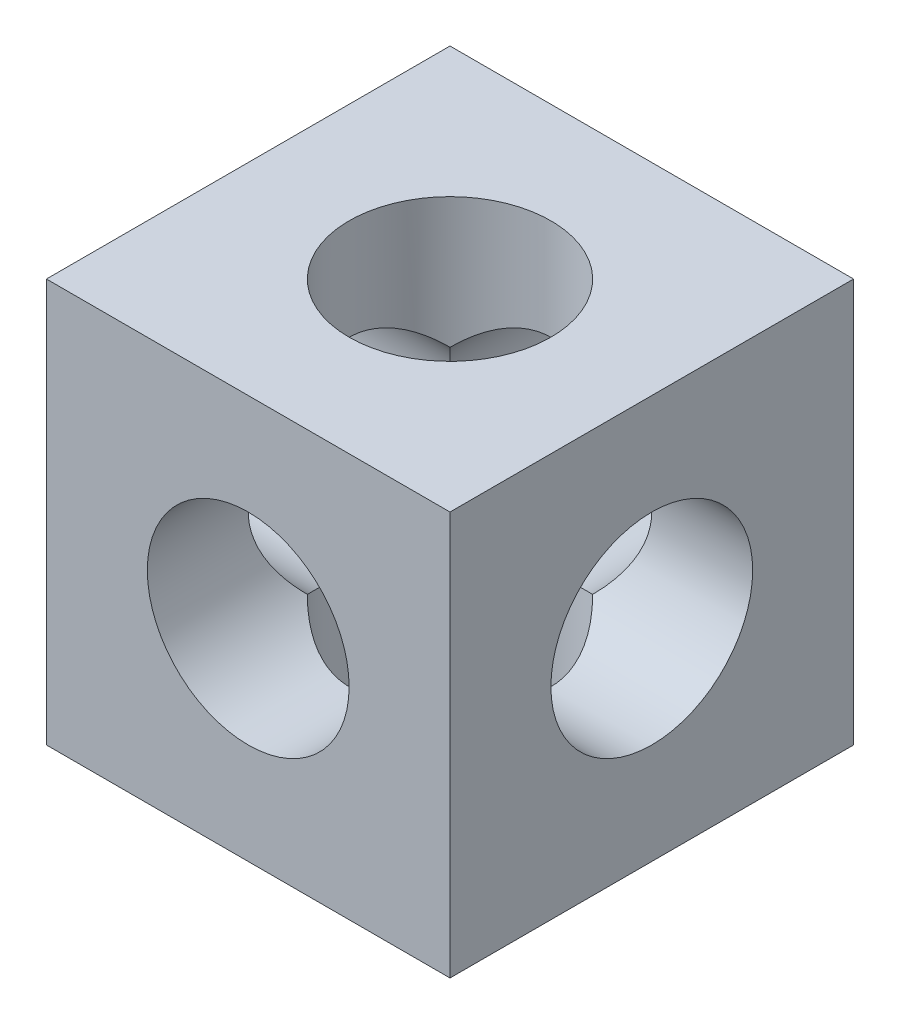
from build123d import *

# Parameters (mm, degrees)
SKETCH_1_W          = 6
SKETCH_1_H          = 6
SKETCH_1_R          = 1.5
EXTRUDE_1_DEPTH     = 6
SKETCH_2_R          = 1.5
CUT_EXTRUDE_1_DEPTH = 6
SKETCH_3_R          = 1.5
CUT_EXTRUDE_2_DEPTH = 6


with BuildPart() as part:
    # 草图1 → 凸台-拉伸1 (new body)
    with BuildSketch(Plane(origin=(0, 0, 0), x_dir=(1, 0, 0), z_dir=(0, 1, 0))):
        with Locations((3, 3)):
            Rectangle(SKETCH_1_W, SKETCH_1_H)
        with Locations(Location((3, 3, 0), (0, 0, 270))):
            Circle(SKETCH_1_R, mode=Mode.SUBTRACT)
    extrude(amount=EXTRUDE_1_DEPTH)

    # 草图2 → 切除-拉伸1 (cut)
    with BuildSketch(Plane.XY):
        with Locations((3, 3)):
            Circle(SKETCH_2_R)
    extrude(amount=-CUT_EXTRUDE_1_DEPTH, mode=Mode.SUBTRACT)

    # 草图3 → 切除-拉伸2 (cut)
    with BuildSketch(Plane(origin=(6, 0, 0), x_dir=(0, 0, -1), z_dir=(1, 0, 0))):
        with Locations((3, 3)):
            Circle(SKETCH_3_R)
    extrude(amount=-CUT_EXTRUDE_2_DEPTH, mode=Mode.SUBTRACT)


solid = part.part
